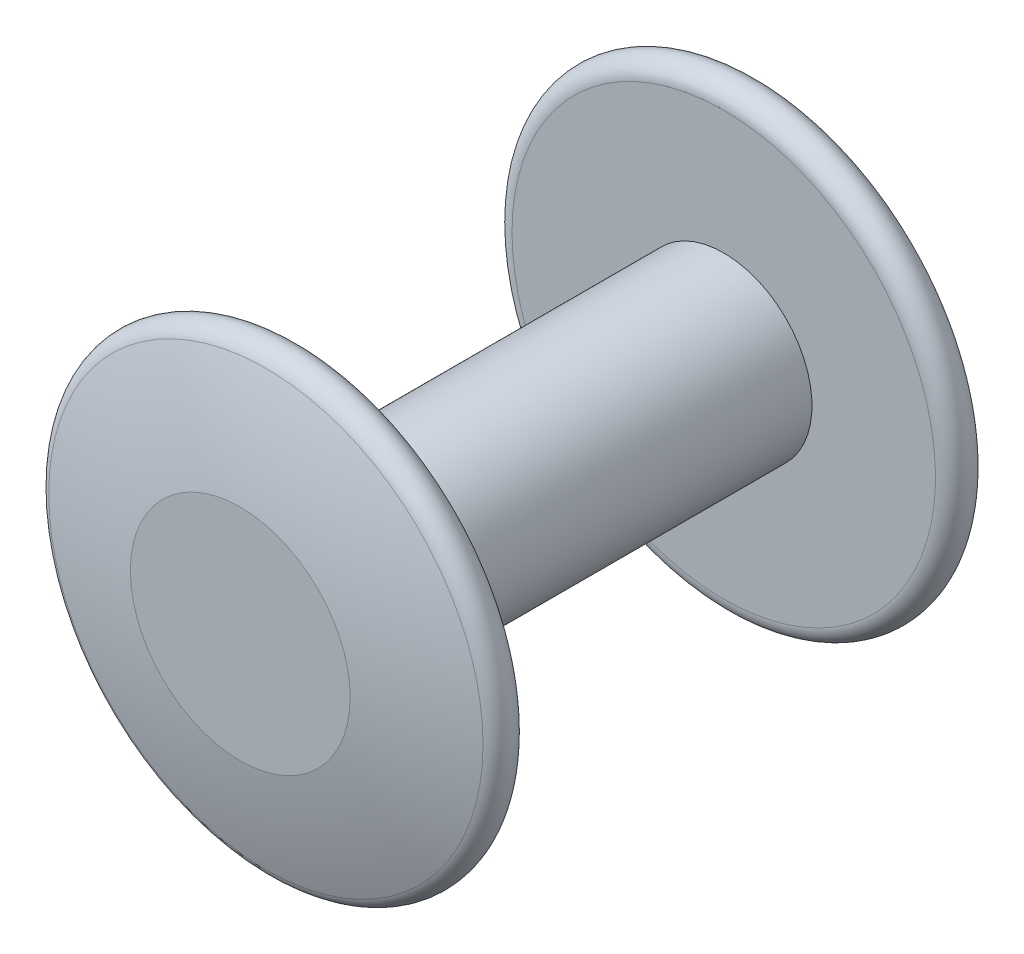
from build123d import *


with BuildPart() as part:
    # Sketch1 → Revolve1 (revolve)
    with BuildSketch(Plane.XZ, mode=Mode.PRIVATE) as revolve1_sk:
        with BuildLine():
            Line((3.114934555, 7.701965126), (0, 7.701965126))
            Line((0, 7.701965126), (0, -7.701965126))
            Line((0, -7.701965126), (3.114934555, -7.701965126))
            ThreePointArc((3.114934555, -7.701965126), (4.648593724, -7.398288727), (6.153846154, -6.975742957))
            ThreePointArc((6.153846154, -6.975742957), (6.493898511, -6.422126636), (6, -6))
            Line((6, -6), (2.5, -6))
            Line((2.5, -6), (2.5, 6))
            Line((2.5, 6), (6, 6))
            ThreePointArc((6, 6), (6.493898511, 6.422126636), (6.153846154, 6.975742957))
            ThreePointArc((6.153846154, 6.975742957), (4.648593724, 7.398288727), (3.114934555, 7.701965126))
        make_face()
    revolve(revolve1_sk.sketch.rotate(Axis((0, 0, 7.701965126), (0, 0, -1)), 180), axis=Axis((0, 0, 7.701965126), (0, 0, -1)))


solid = part.part
